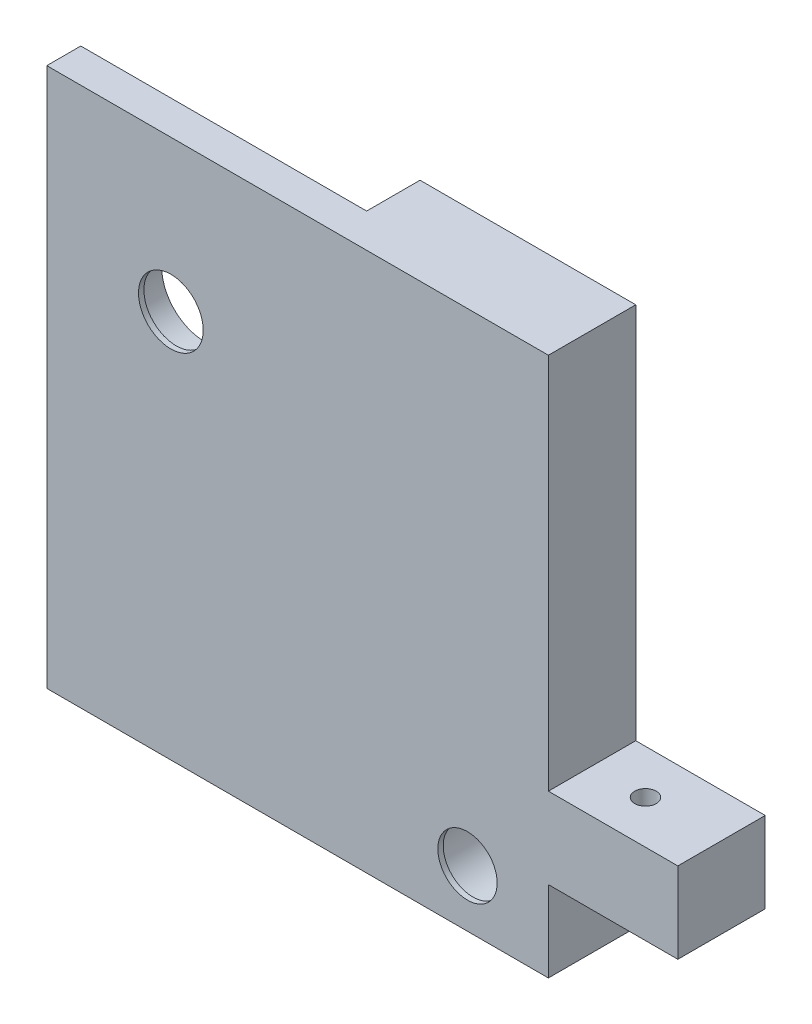
from build123d import *

# Parameters (mm, degrees)
SKETCH1_W           = 93
SKETCH1_H           = 100
BOSS_EXTRUDE2_DEPTH = 6.3
SKETCH3_W           = 40
SKETCH3_H           = 100
BOSS_EXTRUDE3_DEPTH = 9.9
SKETCH4_W           = 16.2
SKETCH4_H           = 15
BOSS_EXTRUDE4_DEPTH = 24
SKETCH5_R           = 2
CUT_EXTRUDE1_DEPTH  = 50
SKETCH6_R           = 7.5
CUT_EXTRUDE2_DEPTH  = 50
SKETCH7_R           = 8
CUT_EXTRUDE3_DEPTH  = 50
EXTRUDE_THIN1_START = -5.3
SKETCH7_2_R         = 8
SKETCH7_2_R_2       = 6
EXTRUDE_THIN1_DEPTH = 1
EXTRUDE_THIN2_START = -15.2
SKETCH6_2_R         = 7.5
SKETCH6_2_R_2       = 5.5
EXTRUDE_THIN2_DEPTH = 1


with BuildPart() as part:
    # Sketch1 → Boss-Extrude2 (new body)
    with BuildSketch(Plane.XY):
        with Locations((-29.68705036, 14.928057554)):
            Rectangle(SKETCH1_W, SKETCH1_H)
    extrude(amount=BOSS_EXTRUDE2_DEPTH)

    # Sketch3 → Boss-Extrude3 (add)
    with BuildSketch(Plane(origin=(0, 0, 0), x_dir=(-1, 0, 0), z_dir=(0, 0, -1))):
        with Locations((3.18705036, 14.928057554)):
            Rectangle(SKETCH3_W, SKETCH3_H)
    extrude(amount=BOSS_EXTRUDE3_DEPTH)

    # Sketch4 → Boss-Extrude4 (add)
    with BuildSketch(Plane(origin=(16.81294964, 0, 0), x_dir=(0, 0, -1), z_dir=(1, 0, 0))):
        with Locations((1.8, -12.571942446)):
            Rectangle(SKETCH4_W, SKETCH4_H)
    extrude(amount=BOSS_EXTRUDE4_DEPTH)

    # Sketch5 → Cut-Extrude1 (cut)
    with BuildSketch(Plane(origin=(0, -5.071942446, 0), x_dir=(1, 0, 0), z_dir=(0, 1, 0))):
        with Locations(Location((26.81294964, 1.7, 0), (0, 0, 180))):
            Circle(SKETCH5_R)
    extrude(amount=-CUT_EXTRUDE1_DEPTH, mode=Mode.SUBTRACT)

    # Sketch6 → Cut-Extrude2 (cut)
    with BuildSketch(Plane(origin=(0, 0, -9.9), x_dir=(-1, 0, 0), z_dir=(0, 0, -1))):
        with Locations((-1.81294964, -24.571942446)):
            Circle(SKETCH6_R)
    extrude(amount=-CUT_EXTRUDE2_DEPTH, mode=Mode.SUBTRACT)

    # Sketch7 → Cut-Extrude3 (cut)
    with BuildSketch(Plane(origin=(0, 0, 0), x_dir=(-1, 0, 0), z_dir=(0, 0, -1))):
        with Locations((53.18705036, 36.928057554)):
            Circle(SKETCH7_R)
    extrude(amount=-CUT_EXTRUDE3_DEPTH, mode=Mode.SUBTRACT)

    # Sketch7<2> → Extrude-Thin1 (add)
    with BuildSketch(Plane(origin=(0, 0, 0), x_dir=(-1, 0, 0), z_dir=(0, 0, -1)).offset(EXTRUDE_THIN1_START)):
        with Locations((53.18705036, 36.928057554)):
            Circle(SKETCH7_2_R)
        with Locations((53.18705036, 36.928057554)):
            Circle(SKETCH7_2_R_2, mode=Mode.SUBTRACT)
    extrude(amount=-EXTRUDE_THIN1_DEPTH)

    # Sketch6<2> → Extrude-Thin2 (add)
    with BuildSketch(Plane(origin=(0, 0, -9.9), x_dir=(-1, 0, 0), z_dir=(0, 0, -1)).offset(EXTRUDE_THIN2_START)):
        with Locations((-1.81294964, -24.571942446)):
            Circle(SKETCH6_2_R)
        with Locations((-1.81294964, -24.571942446)):
            Circle(SKETCH6_2_R_2, mode=Mode.SUBTRACT)
    extrude(amount=-EXTRUDE_THIN2_DEPTH)


solid = part.part
